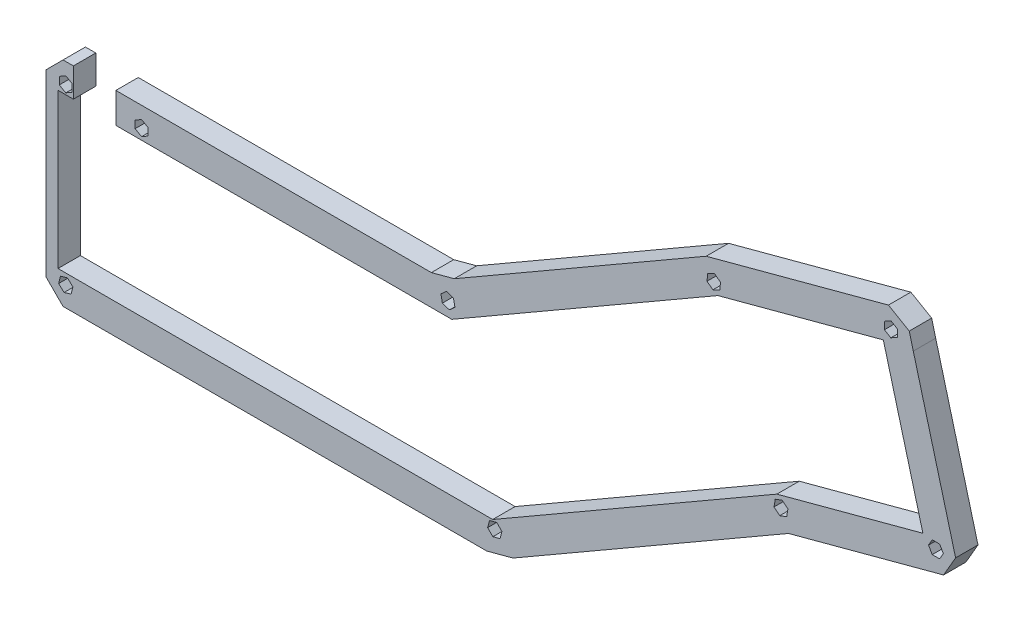
from build123d import *

# Parameters (mm, degrees)
BOSS_EXTRU_1_DEPTH = 8.5


with BuildPart() as part:
    # Esquisse1 → Boss.-Extru.1 (new body)
    with BuildSketch(Plane.XY):
        Polygon((-76.753762562, 40.085106383), (2.011353671, 40.085106383), (50.71612997, 40.085106383), (151.689760112, 98.382258927), (214.4831558, 115.207698591), (229.494660416, 59.184000666), (174.076924484, 44.334863077), (66.257183131, -17.914893617), (-98.698564415, -17.914893617), (-98.698564415, 40.655573641), (-94.860830925, 40.655573641), (-92.861789188, 40.655573641), (-92.861789188, 48.636078378), (-92.861789188, 50.298812036), (-92.861789188, 51.585106383), (-94.860830925, 51.585106383), (-96.789296468, 51.585106383), (-103.253762562, 45.120640289), (-103.253762562, 35.79522772), (-103.253762562, -22.950427523), (-96.789296468, -29.414893617), (63.997857106, -29.414893617), (73.963816863, -26.744522748), (178.515758799, 33.618569072), (237.335031683, 49.379145741), (241.906099495, 57.296467436), (230.508864659, 99.83152691), (225.851857518, 117.211714172), (224.321712805, 123.047343228), (216.426306891, 127.634040432), (210.540810955, 126.057026548), (147.250925797, 109.098552931), (51.669750275, 53.914735514), (42.975455994, 51.585106383), (-75.988646329, 51.585106383), (-76.753762562, 51.585106383), (-76.753762562, 50.298812036), (-76.753762562, 49.585106383), (-76.753762562, 48.636078378), align=None)
        Polygon((-95.09515421, -19.181421764), (-93.057202321, -21.118529255), (-93.715810673, -23.852001108), (-96.412370914, -24.64836547), (-98.450322803, -22.71125798), (-97.791714451, -19.977786126), align=None, mode=Mode.SUBTRACT)
        Polygon((67.767414571, -18.119374886), (69.755583746, -20.107544061), (69.027863321, -22.82343366), (66.311973721, -23.551154085), (64.323804547, -21.56298491), (65.051524972, -18.847095311), align=None, mode=Mode.SUBTRACT)
        Polygon((-93.318762562, 45.490954288), (-93.318762562, 42.679258478), (-95.753762562, 41.273410572), (-98.188762562, 42.679258478), (-98.188762562, 45.490954288), (-95.753762562, 46.896802194), align=None, mode=Mode.SUBTRACT)
        Polygon((-66.988646329, 46.896802194), (-64.553646329, 45.490954288), (-64.553646329, 42.679258478), (-66.988646329, 41.273410572), (-69.423646329, 42.679258478), (-69.423646329, 45.490954288), align=None, mode=Mode.SUBTRACT)
        Polygon((51.366225237, 47.372350111), (51.931744927, 44.618113227), (49.829265662, 42.751240367), (47.161266708, 43.638604392), (46.595747018, 46.392841276), (48.698226283, 48.259714136), align=None, mode=Mode.SUBTRACT)
        Polygon((176.099626255, 43.341034088), (178.27036991, 41.553995947), (177.808121311, 38.780557726), (175.175129056, 37.794157645), (173.004385401, 39.581195786), (173.466634, 42.354634007), align=None, mode=Mode.SUBTRACT)
        Polygon((235.851309069, 58.804459007), (237.257156975, 56.369459007), (235.851309069, 53.934459007), (233.039613258, 53.934459007), (231.633765353, 56.369459007), (233.039613258, 58.804459007), align=None, mode=Mode.SUBTRACT)
        Polygon((150.436891261, 104.94434728), (152.703485209, 103.280560873), (152.395900888, 100.48573973), (149.821722619, 99.354704995), (147.555128671, 101.018491402), (147.862712992, 103.813312544), align=None, mode=Mode.SUBTRACT)
        Polygon((219.824270363, 121.480626406), (219.771686266, 118.66942235), (217.310820089, 117.309359486), (214.90253801, 118.760500678), (214.955122108, 121.571704735), (217.415988284, 122.931767598), align=None, mode=Mode.SUBTRACT)
    extrude(amount=BOSS_EXTRU_1_DEPTH)


solid = part.part
